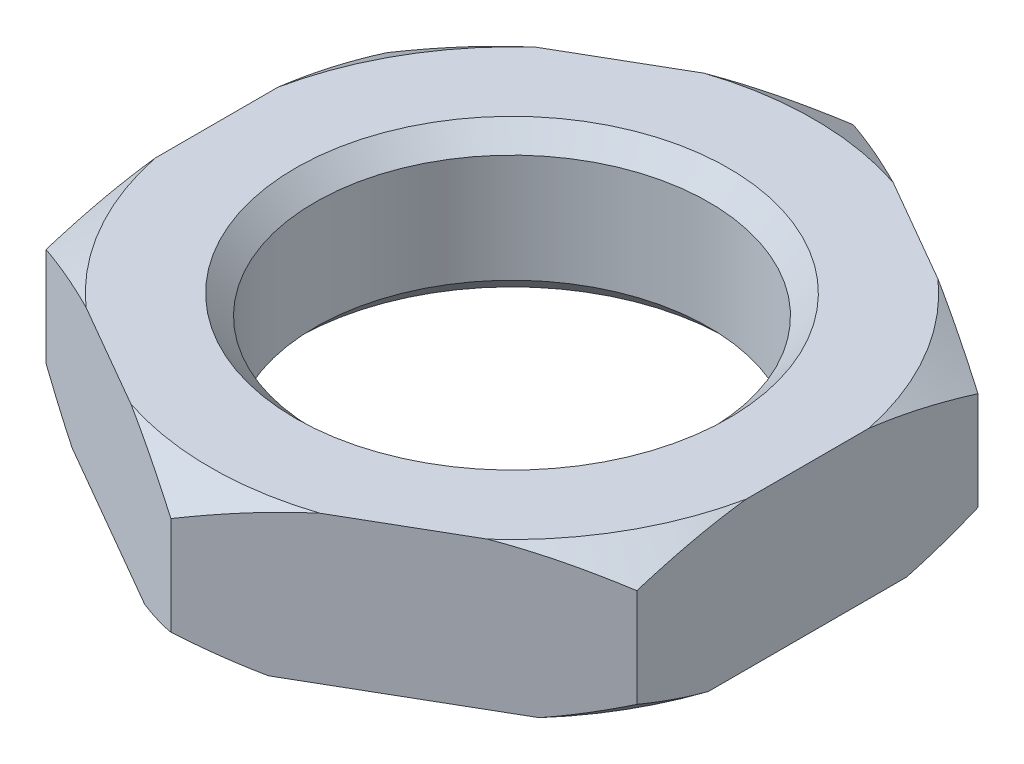
from build123d import *

# Parameters (mm, degrees)
BOSS_EXTRUDE1_DEPTH = 1.5
SKETCH2_R           = 2
CUT_EXTRUDE1_DEPTH  = 5.82182538
CHAMFER1_SIZE       = 0.2


with BuildPart() as part:
    # Sketch1 → Boss-Extrude1 (new body)
    with BuildSketch(Plane(origin=(0, 0, 0), x_dir=(1, 0, 0), z_dir=(0, 1, 0))):
        Polygon((0, -3.464101615), (3, -1.732050808), (3, 1.732050808), (0, 3.464101615), (-3, 1.732050808), (-3, -1.732050808), align=None)
    extrude(amount=BOSS_EXTRUDE1_DEPTH)

    # Sketch2 → Cut-Extrude1 (cut, through all)
    with BuildSketch(Plane(origin=(0, 1.5, 0), x_dir=(1, 0, 0), z_dir=(0, 1, 0))):
        with Locations(Location((0, 0, 0), (0, 0, 270))):
            Circle(SKETCH2_R)
    extrude(amount=-CUT_EXTRUDE1_DEPTH, mode=Mode.SUBTRACT)

    # Chamfer1
    chamfer1_edges = [part.edges().sort_by_distance(p)[0] for p in [
        (0, 0, -2),
        (0, 1.5, -2),
    ]]
    chamfer(chamfer1_edges, length=CHAMFER1_SIZE)

    # Sketch3 → Cut-Revolve3 (revolve, cut)
    with BuildSketch(Plane(origin=(0, 0, 0), x_dir=(0, 0, -1), z_dir=(1, 0, 0))):
        Polygon((-3.464101615, 1.5), (-3.464101615, 1.25), (-3.064101615, 1.5), align=None)
        Polygon((-3.164101615, 0), (-3.464101615, 0.25), (-3.464101615, 0), align=None)
    revolve(axis=Axis((0, 3.371957125, 0), (0, -1, 0)), mode=Mode.SUBTRACT)


solid = part.part
